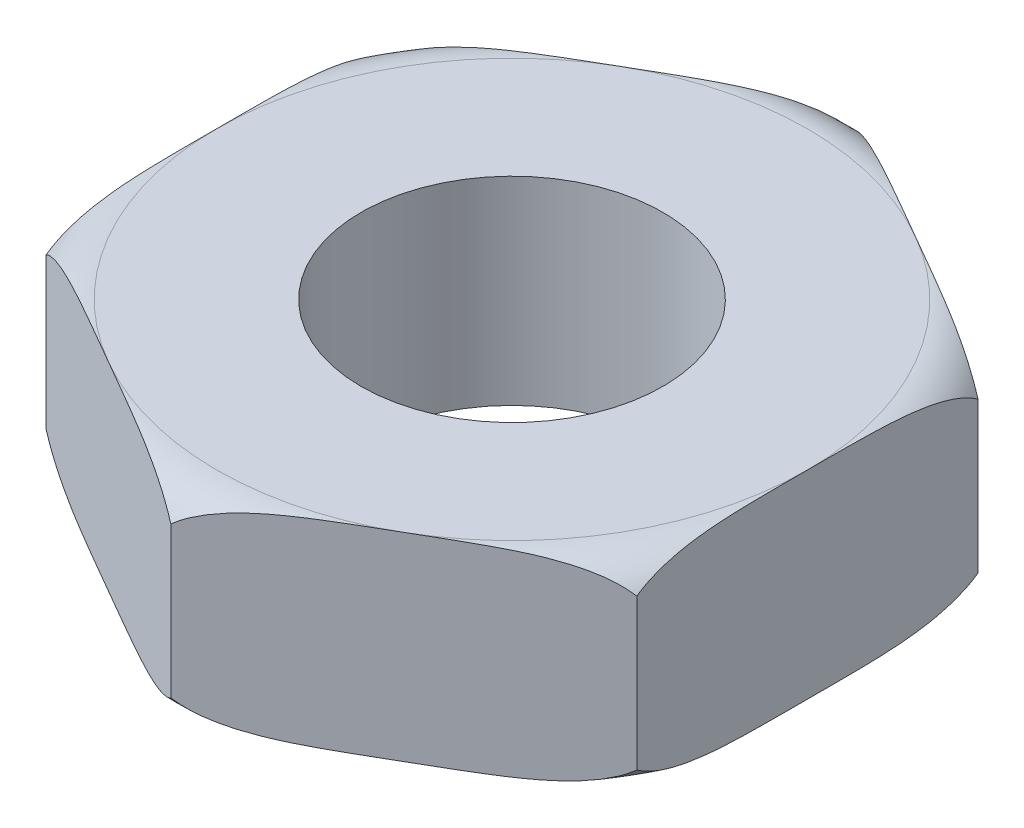
from build123d import *

# Parameters (mm, degrees)
SKETCH2_R           = 2.413
BOSS_EXTRUDE2_DEPTH = 3.175


with BuildPart() as part:
    # Sketch2 → Boss-Extrude2 (new body)
    with BuildSketch(Plane(origin=(0, 0, 0), x_dir=(1, 0, 0), z_dir=(0, 1, 0))):
        Polygon((4.7244, 2.727633612), (0, 5.455267224), (-4.7244, 2.727633612), (-4.7244, -2.727633612), (0, -5.455267224), (4.7244, -2.727633612), align=None)
        with Locations(Location((0, 0, 0), (0, 0, 270))):
            Circle(SKETCH2_R, mode=Mode.SUBTRACT)
    extrude(amount=-BOSS_EXTRUDE2_DEPTH)

    # Sketch4 → Cut-Revolve1 (revolve, cut)
    with BuildSketch(Plane(origin=(0, 0, 0), x_dir=(0, 0, -1), z_dir=(1, 0, 0))):
        with BuildLine():
            Line((4.7244, 0), (0, 0))
            Line((0, 0), (0, 0.47939604))
            Line((0, 0.47939604), (5.455267224, 0.47939604))
            Line((5.455267224, 0.47939604), (5.455267224, -0.382883312))
            ThreePointArc((5.455267224, -0.382883312), (5.136942885, -0.101517068), (4.7244, 0))
        make_face()
        with BuildLine():
            Line((0, -3.65439604), (5.455267224, -3.65439604))
            Line((5.455267224, -3.65439604), (5.455267224, -2.792116688))
            ThreePointArc((5.455267224, -2.792116688), (5.136942885, -3.073482932), (4.7244, -3.175))
            Line((4.7244, -3.175), (0, -3.175))
            Line((0, -3.175), (0, -3.65439604))
        make_face()
    revolve(axis=Axis((0, -0.257604259, 0), (0, -1, 0)), mode=Mode.SUBTRACT)


solid = part.part
